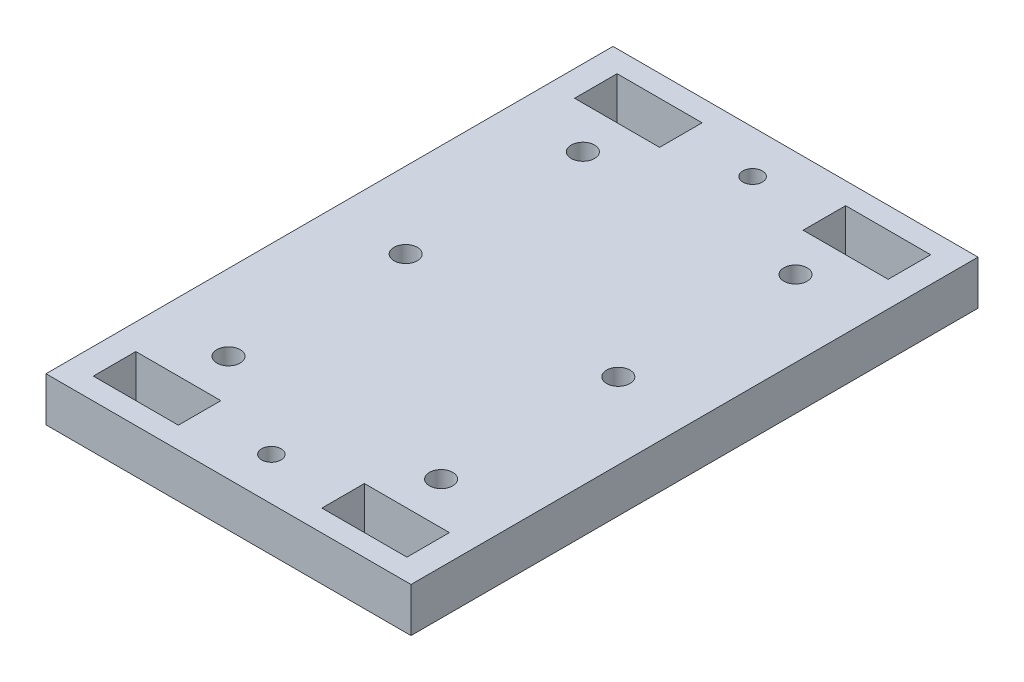
from build123d import *

# Parameters (mm, degrees)
SKETCH1_W           = 51.5
SKETCH1_H           = 80
SKETCH1_R           = 1.65
SKETCH1_R_2         = 1.375
SKETCH1_W_2         = 12
SKETCH1_H_2         = 6
BOSS_EXTRUDE1_DEPTH = 6.25


with BuildPart() as part:
    # Sketch1 → Boss-Extrude1 (new body)
    with BuildSketch(Plane(origin=(0, 0, 0), x_dir=(1, 0, 0), z_dir=(0, 1, 0))):
        with Locations((25.75, 40)):
            Rectangle(SKETCH1_W, SKETCH1_H)
        with Locations(Location((10.75, 15, 0), (0, 0, 270))):
            Circle(SKETCH1_R, mode=Mode.SUBTRACT)
        with Locations(Location((40.75, 15, 0), (0, 0, 270))):
            Circle(SKETCH1_R, mode=Mode.SUBTRACT)
        with Locations(Location((25.75, 73.95, 0), (0, 0, 270))):
            Circle(SKETCH1_R_2, mode=Mode.SUBTRACT)
        with Locations(Location((40.75, 40, 0), (0, 0, 270))):
            Circle(SKETCH1_R, mode=Mode.SUBTRACT)
        with Locations(Location((25.75, 6.05, 0), (0, 0, 270))):
            Circle(SKETCH1_R_2, mode=Mode.SUBTRACT)
        with Locations(Location((40.75, 65, 0), (0, 0, 270))):
            Circle(SKETCH1_R, mode=Mode.SUBTRACT)
        with Locations(Location((10.75, 40, 0), (0, 0, 270))):
            Circle(SKETCH1_R, mode=Mode.SUBTRACT)
        with Locations(Location((10.75, 65, 0), (0, 0, 270))):
            Circle(SKETCH1_R, mode=Mode.SUBTRACT)
        with Locations((41.875, 73.95)):
            Rectangle(SKETCH1_W_2, SKETCH1_H_2, mode=Mode.SUBTRACT)
        with Locations((41.875, 6.05)):
            Rectangle(SKETCH1_W_2, SKETCH1_H_2, mode=Mode.SUBTRACT)
        with Locations((9.625, 6.05)):
            Rectangle(SKETCH1_W_2, SKETCH1_H_2, mode=Mode.SUBTRACT)
        with Locations((9.625, 73.95)):
            Rectangle(SKETCH1_W_2, SKETCH1_H_2, mode=Mode.SUBTRACT)
    extrude(amount=BOSS_EXTRUDE1_DEPTH)


solid = part.part
